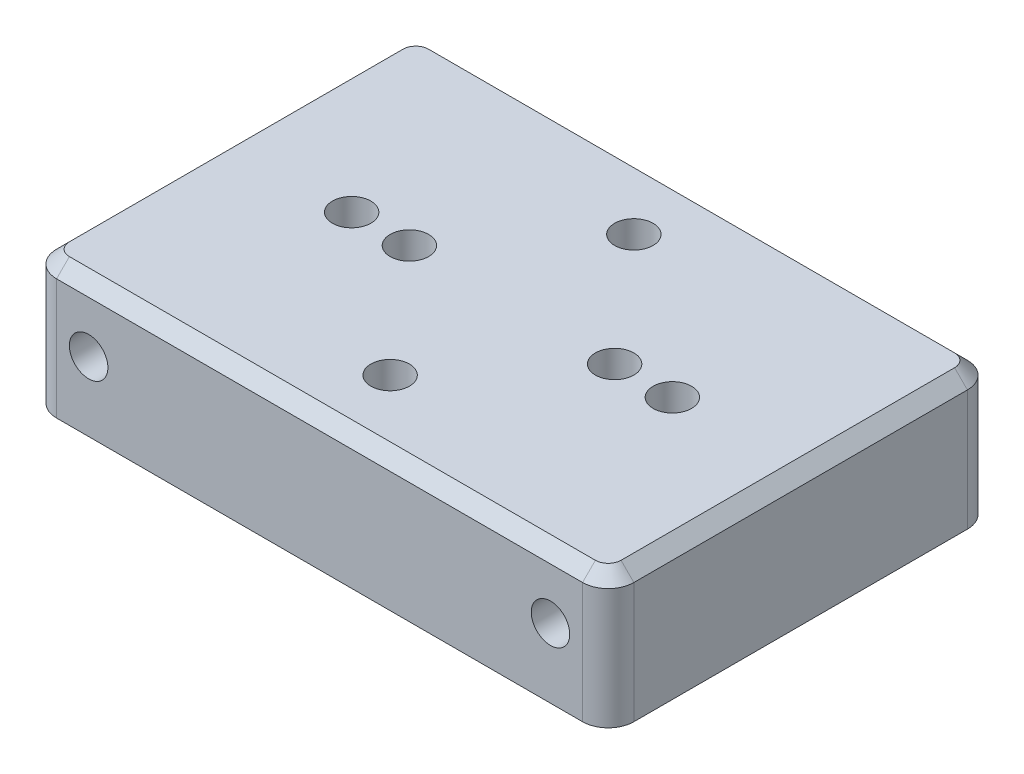
from build123d import *
from build123d.topology import SkipClean

# Parameters (mm, degrees)
SKETCH_1_W          = 45
SKETCH_1_H          = 30
SKETCH_1_R          = 1.5
EXTRUDE_1_DEPTH     = 10
SKETCH_2_R          = 1.5
CUT_EXTRUDE_1_DEPTH = 39.810436741
FILLET_1_R          = 2
CHAMFER_2_SIZE      = 1
SKETCH_3_R          = 1.5
CUT_EXTRUDE_2_DEPTH = 5
EXTRUDE_START       = 0.4
SKETCH_4_R          = 1.5
EXTRUDE_2_DEPTH     = 0.4


with BuildPart() as part:
    # 스케치1 → 보스-돌출1 (new body)
    with BuildSketch(Plane(origin=(0, 0, 0), x_dir=(1, 0, 0), z_dir=(0, 1, 0))):
        Rectangle(SKETCH_1_W, SKETCH_1_H)
        with Locations(Location((-8, 0, 0), (0, 0, 270))):
            Circle(SKETCH_1_R, mode=Mode.SUBTRACT)
        with Locations(Location((8, 0, 0), (0, 0, 270))):
            Circle(SKETCH_1_R, mode=Mode.SUBTRACT)
        with Locations(Location((0, 9.5, 0), (0, 0, 270))):
            Circle(SKETCH_1_R, mode=Mode.SUBTRACT)
        with Locations(Location((0, -9.5, 0), (0, 0, 270))):
            Circle(SKETCH_1_R, mode=Mode.SUBTRACT)
        with Locations(Location((-12.5, 0, 0), (0, 0, 270))):
            Circle(SKETCH_1_R, mode=Mode.SUBTRACT)
        with Locations(Location((12.5, 0, 0), (0, 0, 270))):
            Circle(SKETCH_1_R, mode=Mode.SUBTRACT)
    extrude(amount=EXTRUDE_1_DEPTH)

    # 스케치2 → 컷-돌출1 (cut, through all)
    with BuildSketch(Plane.XY.offset(15)):
        with Locations((-18, 5)):
            Circle(SKETCH_2_R)
        with Locations(Location((18, 5, 0), (0, 0, 180))):
            Circle(SKETCH_2_R)
    extrude(amount=-CUT_EXTRUDE_1_DEPTH, mode=Mode.SUBTRACT)

    # 필렛1
    fillet_1_edges = [part.edges().sort_by_distance(p)[0] for p in [
        (22.5, 5, 15),
        (-22.5, 5, 15),
        (-22.5, 5, -15),
        (22.5, 5, -15),
    ]]
    fillet(fillet_1_edges, radius=FILLET_1_R)

    # 모따기2
    chamfer_2_edges = [part.edges().sort_by_distance(p)[0] for p in [
        (22.5, 10, 0),
        (0, 10, 15),
        (0, 10, -15),
        (-22.5, 10, 0),
        (-21.914213562, 10, 14.414213562),
        (-21.914213562, 10, -14.414213562),
        (21.914213562, 10, -14.414213562),
        (21.914213562, 10, 14.414213562),
    ]]
    chamfer(chamfer_2_edges, length=CHAMFER_2_SIZE)

    # 스케치3 → 컷-돌출2 (cut)
    with BuildSketch(Plane.XZ):
        with Locations(Location((-18, 0, 0), (0, 0, 270))):
            Circle(SKETCH_3_R)
        with Locations((18, 0)):
            Circle(SKETCH_3_R)
    extrude(amount=-CUT_EXTRUDE_2_DEPTH, mode=Mode.SUBTRACT)

    # 스케치4 → 보스-돌출2 (add)
    with SkipClean():  # the faces are left unmerged after this step: merging them gives an invalid solid
        with BuildSketch(Plane.XZ.offset(EXTRUDE_START)):
            with BuildLine():
                Line((22.5, -13), (22.5, 13))
                ThreePointArc((22.5, 13), (21.914213562, 14.414213562), (20.5, 15))
                Line((20.5, 15), (-20.5, 15))
                ThreePointArc((-20.5, 15), (-21.914213562, 14.414213562), (-22.5, 13))
                Line((-22.5, 13), (-22.5, -13))
                ThreePointArc((-22.5, -13), (-21.914213562, -14.414213562), (-20.5, -15))
                Line((-20.5, -15), (20.5, -15))
                ThreePointArc((20.5, -15), (21.914213562, -14.414213562), (22.5, -13))
            make_face()
            with Locations(Location((-18, 0, 0), (0, 0, 270))):
                Circle(SKETCH_4_R, mode=Mode.SUBTRACT)
            with Locations(Location((-12.5, 0, 0), (0, 0, 270))):
                Circle(SKETCH_4_R, mode=Mode.SUBTRACT)
            with Locations(Location((-8, 0, 0), (0, 0, 270))):
                Circle(SKETCH_4_R, mode=Mode.SUBTRACT)
            with Locations(Location((0, -9.5, 0), (0, 0, 270))):
                Circle(SKETCH_4_R, mode=Mode.SUBTRACT)
            with Locations(Location((8, 0, 0), (0, 0, 270))):
                Circle(SKETCH_4_R, mode=Mode.SUBTRACT)
            with Locations(Location((12.5, 0, 0), (0, 0, 270))):
                Circle(SKETCH_4_R, mode=Mode.SUBTRACT)
            with Locations(Location((0, 9.5, 0), (0, 0, 270))):
                Circle(SKETCH_4_R, mode=Mode.SUBTRACT)
            with Locations(Location((18, 0, 0), (0, 0, 270))):
                Circle(SKETCH_4_R, mode=Mode.SUBTRACT)
        extrude(amount=-EXTRUDE_2_DEPTH)


solid = part.part
